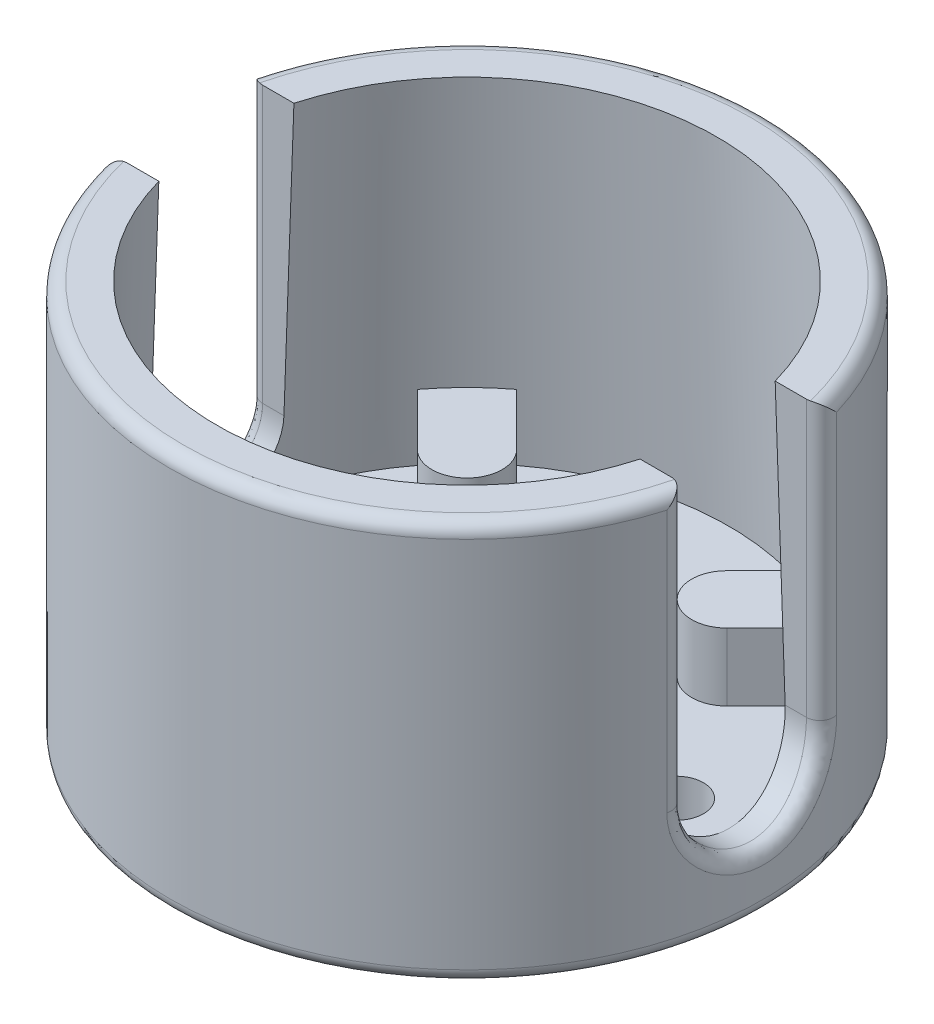
from build123d import *

# Parameters (mm, degrees)
SKETCH1_R           = 11
BOSS_EXTRUDE1_DEPTH = 14.8
SKETCH2_R           = 9.25
CUT_EXTRUDE1_DEPTH  = 12.7
CUT_EXTRUDE1_DRAFT  = 2
CUT_EXTRUDE2_REACH  = 22.082
SKETCH3_R           = 5.5
BOSS_EXTRUDE2_DEPTH = 2.5
CUT_EXTRUDE3_DEPTH  = 29.706096913
CUT_EXTRUDE4_REACH  = 23.472
SKETCH7_R           = 1
FILLET1_R           = 0.5


with BuildPart() as part:
    # Sketch1 → Boss-Extrude1 (new body)
    with BuildSketch(Plane(origin=(0, 0, 0), x_dir=(1, 0, 0), z_dir=(0, 1, 0))):
        with Locations(Location((0, 0, 0), (0, 0, 270))):
            Circle(SKETCH1_R)
    extrude(amount=BOSS_EXTRUDE1_DEPTH)


with BuildPart() as cut_extrude1_tool:
    # Sketch2 → Cut-Extrude1 (with draft: the straight prism first)
    with BuildSketch(Plane(origin=(0, 14.8, 0), x_dir=(1, 0, 0), z_dir=(0, 1, 0))):
        Circle(SKETCH2_R)
    extrude(amount=-CUT_EXTRUDE1_DEPTH)
    # Cut-Extrude1: the draft: its side faces are tilted about the plane it starts from
    cut_extrude1_sides = [cut_extrude1_tool.faces().sort_by_distance(p)[0] for p in [
        (-9.25, 8.45, 0),
    ]]
    draft(cut_extrude1_sides, Plane(origin=(0, 14.8, 0), x_dir=(1, 0, 0), z_dir=(0, 1, 0)), CUT_EXTRUDE1_DRAFT)


with BuildPart() as part_1:
    add(part.part)

    # Cut-Extrude1: cut by cut_extrude1_tool
    add(cut_extrude1_tool.part, mode=Mode.SUBTRACT)

    # Sketch3 → Cut-Extrude2 (cut, up to next)
    with BuildSketch(Plane(origin=(0, 2.1, 0), x_dir=(1, 0, 0), z_dir=(0, 1, 0)), mode=Mode.PRIVATE) as cut_extrude2_sk1:
        with Locations(Location((0, 0, 0), (0, 0, 270))):
            Circle(SKETCH3_R)
    cut_extrude2_tool1 = extrude(cut_extrude2_sk1.sketch, amount=-CUT_EXTRUDE2_REACH, mode=Mode.PRIVATE) & part_1.part
    add(cut_extrude2_tool1.solids().sort_by_distance((0, 2.1, 0))[0], mode=Mode.SUBTRACT)

    # Sketch4 → Boss-Extrude2 (add)
    with BuildSketch(Plane(origin=(0, 2.1, 0), x_dir=(1, 0, 0), z_dir=(0, 1, 0))):
        with BuildLine():
            Line((3.889087297, 5.727564928), (5.873176864, 7.711654495))
            ThreePointArc((5.873176864, 7.711654495), (6.85433518, 6.85433518), (7.711654495, 5.873176864))
            Line((7.711654495, 5.873176864), (5.727564928, 3.889087297))
            ThreePointArc((5.727564928, 3.889087297), (3.889087297, 3.889087297), (3.889087297, 5.727564928))
        make_face()
        with BuildLine():
            Line((3.889087297, -5.727564928), (5.873176864, -7.711654495))
            ThreePointArc((5.873176864, -7.711654495), (6.85433518, -6.85433518), (7.711654495, -5.873176864))
            Line((7.711654495, -5.873176864), (5.727564928, -3.889087297))
            ThreePointArc((5.727564928, -3.889087297), (3.889087297, -3.889087297), (3.889087297, -5.727564928))
        make_face()
        with BuildLine():
            Line((-5.727564928, -3.889087297), (-7.711654495, -5.873176864))
            ThreePointArc((-7.711654495, -5.873176864), (-6.85433518, -6.85433518), (-5.873176864, -7.711654495))
            Line((-5.873176864, -7.711654495), (-3.889087297, -5.727564928))
            ThreePointArc((-3.889087297, -5.727564928), (-3.889087297, -3.889087297), (-5.727564928, -3.889087297))
        make_face()
        with BuildLine():
            Line((-3.889087297, 5.727564928), (-5.873176864, 7.711654495))
            ThreePointArc((-5.873176864, 7.711654495), (-6.85433518, 6.85433518), (-7.711654495, 5.873176864))
            Line((-7.711654495, 5.873176864), (-5.727564928, 3.889087297))
            ThreePointArc((-5.727564928, 3.889087297), (-3.889087297, 3.889087297), (-3.889087297, 5.727564928))
        make_face()
    extrude(amount=BOSS_EXTRUDE2_DEPTH)

    # Sketch6 → Cut-Extrude3 (cut, through all)
    with BuildSketch(Plane.ZY.offset(11)):
        with BuildLine():
            Line((-2.5, 4.6), (-2.5, 14.8))
            Line((-2.5, 14.8), (2.5, 14.8))
            Line((2.5, 14.8), (2.5, 4.6))
            ThreePointArc((2.5, 4.6), (0, 2.1), (-2.5, 4.6))
        make_face()
    extrude(amount=-CUT_EXTRUDE3_DEPTH, mode=Mode.SUBTRACT)

    # Sketch7 → Cut-Extrude4 (cut, up to next)
    with BuildSketch(Plane.XZ, mode=Mode.PRIVATE) as cut_extrude4_sk1:
        with Locations(Location((7.75, 0, 0), (0, 0, 270))):
            Circle(SKETCH7_R)
    cut_extrude4_tool1 = extrude(cut_extrude4_sk1.sketch, amount=-CUT_EXTRUDE4_REACH, mode=Mode.PRIVATE) & part_1.part
    # Sketch7 → Cut-Extrude4 (cut, up to next)
    with BuildSketch(Plane.XZ, mode=Mode.PRIVATE) as cut_extrude4_sk2:
        with Locations(Location((-7.75, 0, 0), (0, 0, 270))):
            Circle(SKETCH7_R)
    cut_extrude4_tool2 = extrude(cut_extrude4_sk2.sketch, amount=-CUT_EXTRUDE4_REACH, mode=Mode.PRIVATE) & part_1.part
    add(cut_extrude4_tool1.solids().sort_by_distance((7.75, 0, 0))[0], mode=Mode.SUBTRACT)
    add(cut_extrude4_tool2.solids().sort_by_distance((-7.75, 0, 0))[0], mode=Mode.SUBTRACT)

    # Fillet1
    fillet1_edges = [part_1.edges().sort_by_distance(p)[0] for p in [
        (0, 0, -11),
        (0, 14.8, -11),
        (6.837397166, 14.8, 8.61684397),
        (-10.712142643, 9.7, -2.5),
        (10.712142643, 9.7, -2.5),
        (-10.712142643, 9.7, 2.5),
        (10.712142643, 9.7, 2.5),
        (10.999999996, 2.09999998, 1e-09),
        (-10.999999996, 2.09999998, 1e-09),
    ]]
    fillet(fillet1_edges, radius=FILLET1_R)


solid = part_1.part
